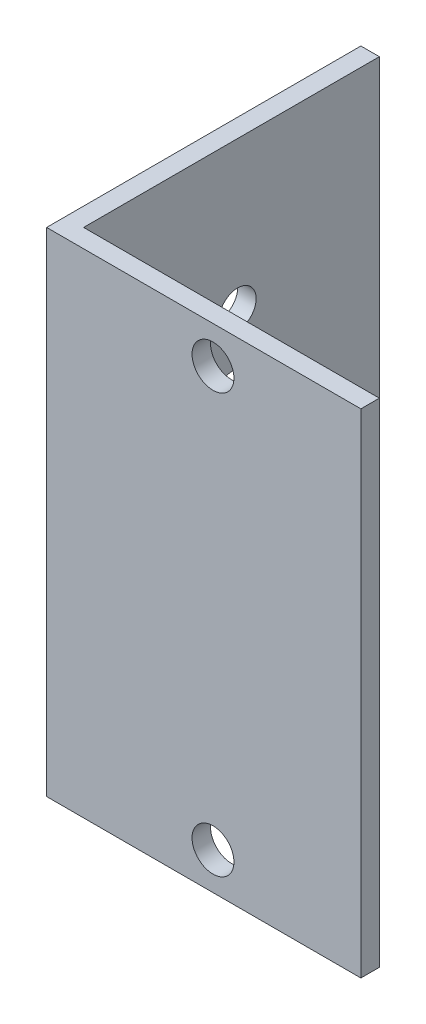
from build123d import *

# Parameters (mm, degrees)
BOSS_EXTRUDE1_DEPTH = 40
SKETCH3_R           = 3.9
SKETCH3_R_2         = 1.5
CUT_EXTRUDE1_DEPTH  = 1.5
SKETCH4_R           = 1.7
CUT_EXTRUDE2_DEPTH  = 10


with BuildPart() as part:
    # Sketch2 → Boss-Extrude1 (new body)
    with BuildSketch(Plane(origin=(0, 0, 0), x_dir=(1, 0, 0), z_dir=(0, 1, 0))):
        Polygon((0, 0), (0, 24), (-1.5, 24), (-1.5, -1.5), (24, -1.5), (24, 0), align=None)
    extrude(amount=BOSS_EXTRUDE1_DEPTH)

    # Sketch3 → Cut-Extrude1 (cut)
    with BuildSketch(Plane.ZY.offset(1.5)):
        with Locations((-12.5, 20)):
            Circle(SKETCH3_R)
        with Locations((-12.5, 28)):
            Circle(SKETCH3_R_2)
        with Locations((-12.5, 12)):
            Circle(SKETCH3_R_2)
    extrude(amount=-CUT_EXTRUDE1_DEPTH, mode=Mode.SUBTRACT)

    # Sketch4 → Cut-Extrude2 (cut)
    with BuildSketch(Plane(origin=(0, 0, 0), x_dir=(-1, 0, 0), z_dir=(0, 0, -1))):
        with Locations((-12, 3)):
            Circle(SKETCH4_R)
        with Locations((-12, 37)):
            Circle(SKETCH4_R)
    extrude(amount=-CUT_EXTRUDE2_DEPTH, mode=Mode.SUBTRACT)


solid = part.part
